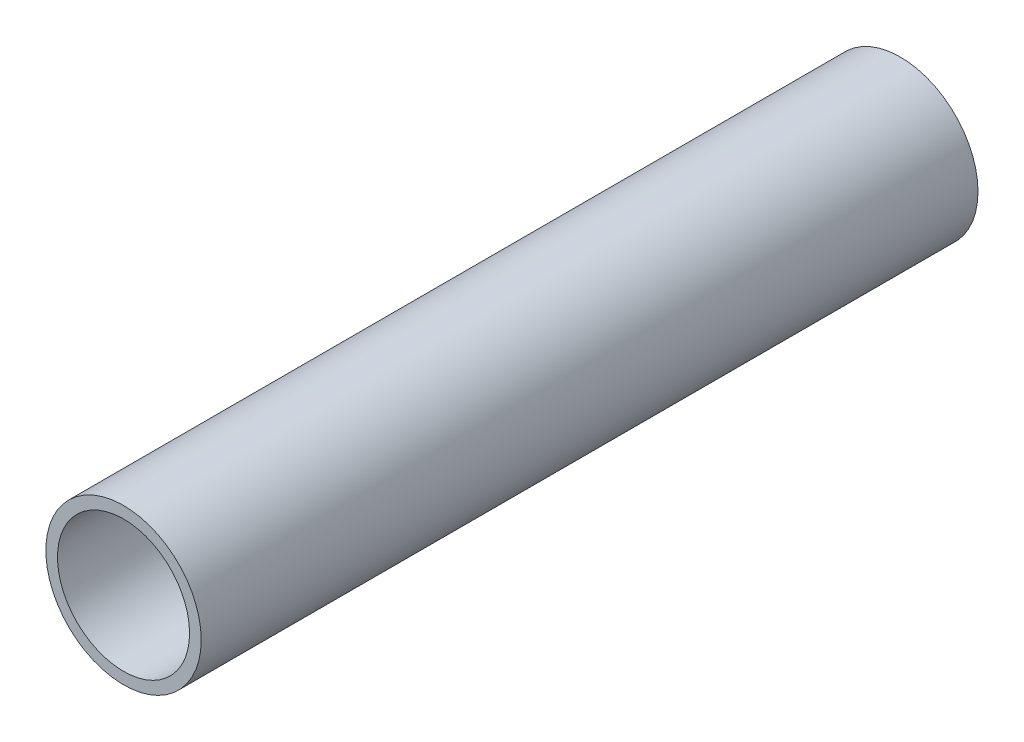
from build123d import *

# Parameters (mm, degrees)
PIPESKETCH_R    = 10
PIPESKETCH_R_2  = 8.5
EXTRUSION_DEPTH = 100


with BuildPart() as part:
    # PipeSketch → Extrusion (new body)
    with BuildSketch(Plane.XY):
        Circle(PIPESKETCH_R)
        Circle(PIPESKETCH_R_2, mode=Mode.SUBTRACT)
    extrude(amount=EXTRUSION_DEPTH)


solid = part.part
